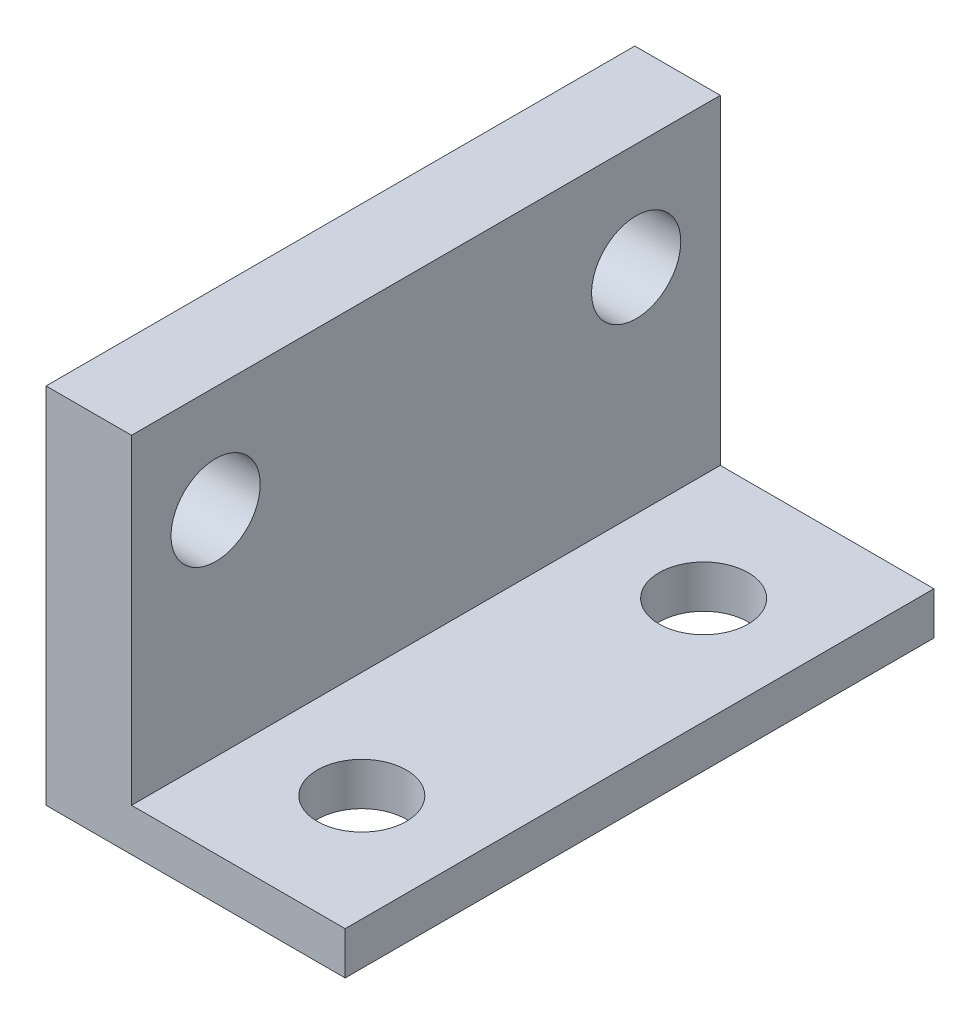
from build123d import *

# Parameters (mm, degrees)
SKETCH1_W             = 5.08
SKETCH1_H             = 19.05
BOSS_EXTRUDE1_DEPTH   = 35
F_5_0MM_DOWEL_HOLE1_D = 5.3
F_5_0MM_DOWEL_HOLE2_D = 5.3


with BuildPart() as part:
    # Sketch1 → Boss-Extrude1 (new body)
    with BuildSketch(Plane.XY):
        Polygon((0, 2.54), (0, 0), (17.78, 0), (17.78, 2.54), (5.08, 2.54), align=None)
        with Locations((2.54, 12.065)):
            Rectangle(SKETCH1_W, SKETCH1_H)
    extrude(amount=BOSS_EXTRUDE1_DEPTH)

    # Ø5.0mm Dowel Hole1 (through all)
    with Locations(Plane(origin=(5.08, 0, 0), x_dir=(0, 0, -1), z_dir=(1, 0, 0))):
        with Locations((-30, 15.24), (-5, 15.24)):
            Hole(F_5_0MM_DOWEL_HOLE1_D / 2)

    # Ø5.0mm Dowel Hole2 (through all)
    with Locations(Plane(origin=(0, 2.54, 0), x_dir=(1, 0, 0), z_dir=(0, 1, 0))):
        with Locations((11.43, -27.66), (11.43, -7.34)):
            Hole(F_5_0MM_DOWEL_HOLE2_D / 2)


solid = part.part
